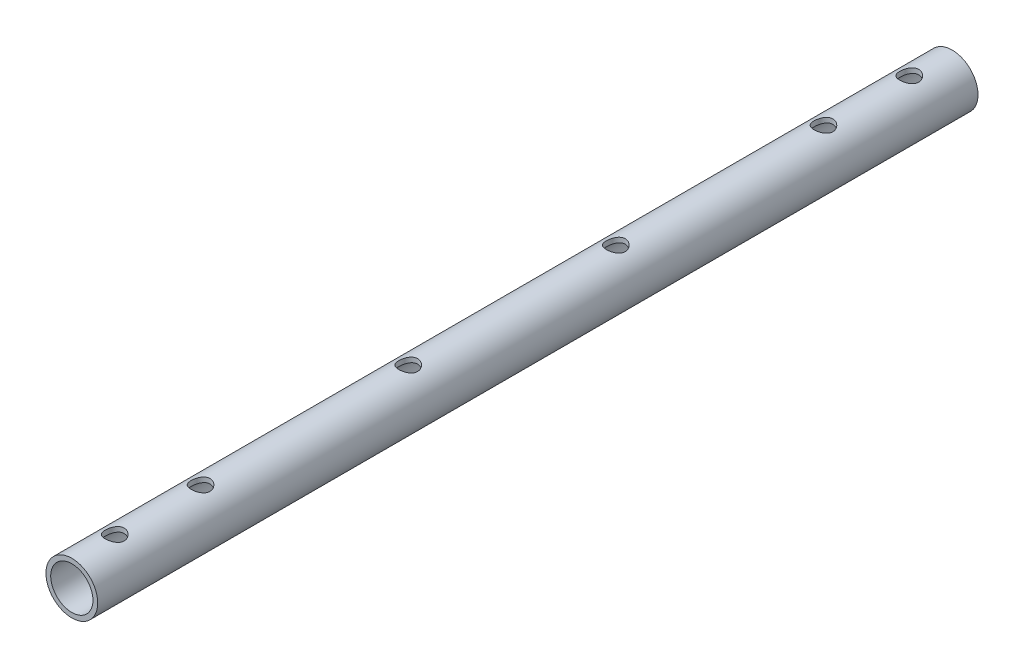
from build123d import *

# Parameters (mm, degrees)
SKETCH1_R               = 30.15
SKETCH1_R_2             = 24.61
BOSS_EXTRUDE1_DEPTH     = 1026
CUT_EXTRUDE1_DEPTH      = 1027.885604632
CUT_EXTRUDE1_DEPTH_BACK = 1027.885604632
SKETCH2_R               = 11
CUT_EXTRUDE2_DEPTH      = 1027.885604738
CUT_EXTRUDE2_DEPTH_BACK = 1027.885604738
SKETCH3_R               = 11


with BuildPart() as part:
    # Sketch1 → Boss-Extrude1 (new body)
    with BuildSketch(Plane.XY):
        Circle(SKETCH1_R)
        Circle(SKETCH1_R_2, mode=Mode.SUBTRACT)
    extrude(amount=BOSS_EXTRUDE1_DEPTH)

    # Sketch2 → Cut-Extrude1 (cut, two sides: drawn at the far end of the back side and taken through both)
    with BuildSketch(Plane(origin=(0, 0, 0), x_dir=(1, 0, 0), z_dir=(0, 1, 0)).offset(-CUT_EXTRUDE1_DEPTH_BACK)):
        with Locations(Location((0, -976, 0), (0, 0, 270))):
            Circle(SKETCH2_R)
        with Locations(Location((0, -876, 0), (0, 0, 270))):
            Circle(SKETCH2_R)
        with Locations(Location((0, -50, 0), (0, 0, 270))):
            Circle(SKETCH2_R)
        with Locations(Location((0, -150, 0), (0, 0, 270))):
            Circle(SKETCH2_R)
    extrude(amount=CUT_EXTRUDE1_DEPTH + CUT_EXTRUDE1_DEPTH_BACK, mode=Mode.SUBTRACT)

    # Sketch3 → Cut-Extrude2 (cut, two sides: drawn at the far end of the back side and taken through both)
    with BuildSketch(Plane(origin=(0, 0, 0), x_dir=(1, 0, 0), z_dir=(0, 1, 0)).offset(-CUT_EXTRUDE2_DEPTH_BACK)):
        with Locations(Location((0, -392, 0), (0, 0, 270))):
            Circle(SKETCH3_R)
        with Locations(Location((0, -634, 0), (0, 0, 270))):
            Circle(SKETCH3_R)
    extrude(amount=CUT_EXTRUDE2_DEPTH + CUT_EXTRUDE2_DEPTH_BACK, mode=Mode.SUBTRACT)


solid = part.part
